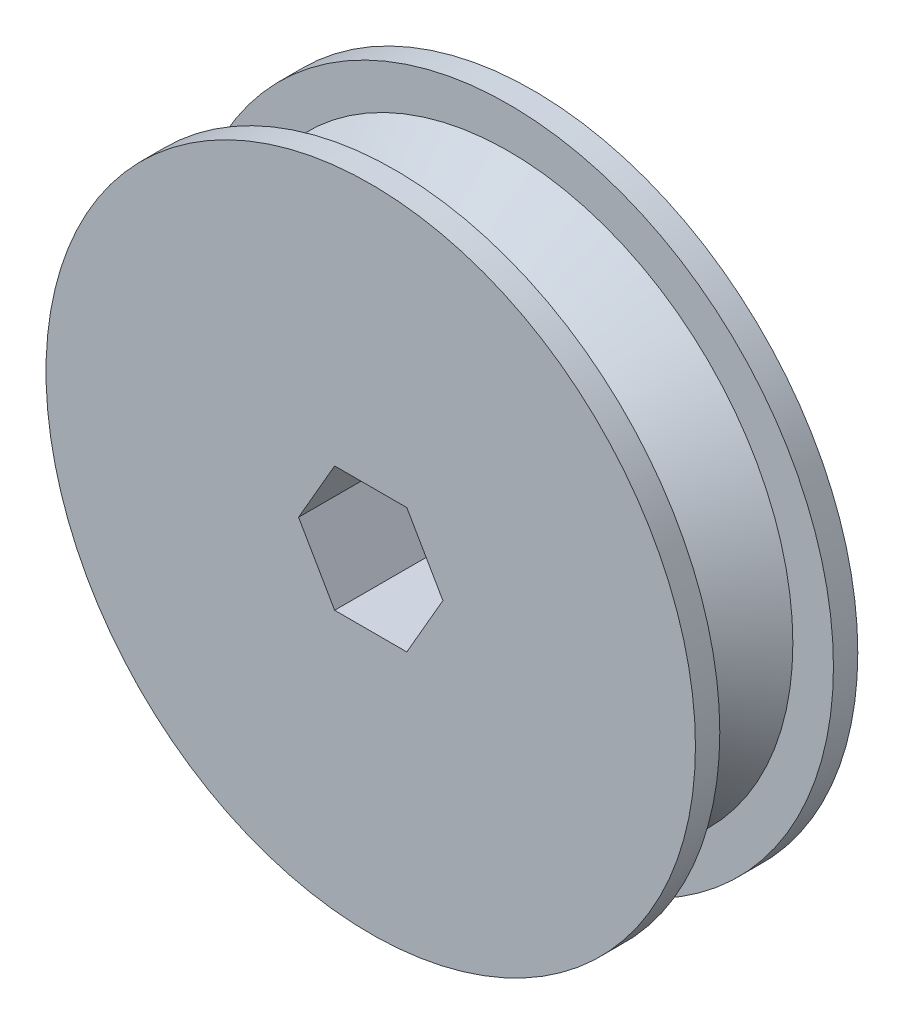
from build123d import *

# Parameters (mm, degrees)
SKETCH1_R           = 25.4
BOSS_EXTRUDE1_DEPTH = 6.35
CUT_EXTRUDE1_DEPTH  = 39.1


with BuildPart() as part:
    # Sketch1 → Boss-Extrude1 (new, symmetric)
    with BuildSketch(Plane.XY):
        Circle(SKETCH1_R)
    extrude(amount=BOSS_EXTRUDE1_DEPTH, both=True)

    # Sketch3 → Cut-Revolve1 (revolve, cut)
    with BuildSketch(Plane(origin=(0, 0, 0), x_dir=(1, 0, 0), z_dir=(0, 1, 0)), mode=Mode.PRIVATE) as cut_revolve1_sk:
        Polygon((-25.4, 4.445), (-25.4, -4.445), (-22.225, -4.445), (-17.78, 0), (-22.225, 4.445), align=None)
    revolve(cut_revolve1_sk.sketch.rotate(Axis((0, 0, 17.119668281), (0, 0, -1)), 180), axis=Axis((0, 0, 17.119668281), (0, 0, -1)), mode=Mode.SUBTRACT)

    # Sketch4 → Cut-Extrude1 (cut, through all)
    with BuildSketch(Plane(origin=(0, 0, -6.35), x_dir=(-1, 0, 0), z_dir=(0, 0, -1))):
        Polygon((5.645908282, 0), (2.822954141, 4.8895), (-2.822954141, 4.8895), (-5.645908282, 0), (-2.822954141, -4.8895), (2.822954141, -4.8895), align=None)
    extrude(amount=-CUT_EXTRUDE1_DEPTH, mode=Mode.SUBTRACT)


solid = part.part
